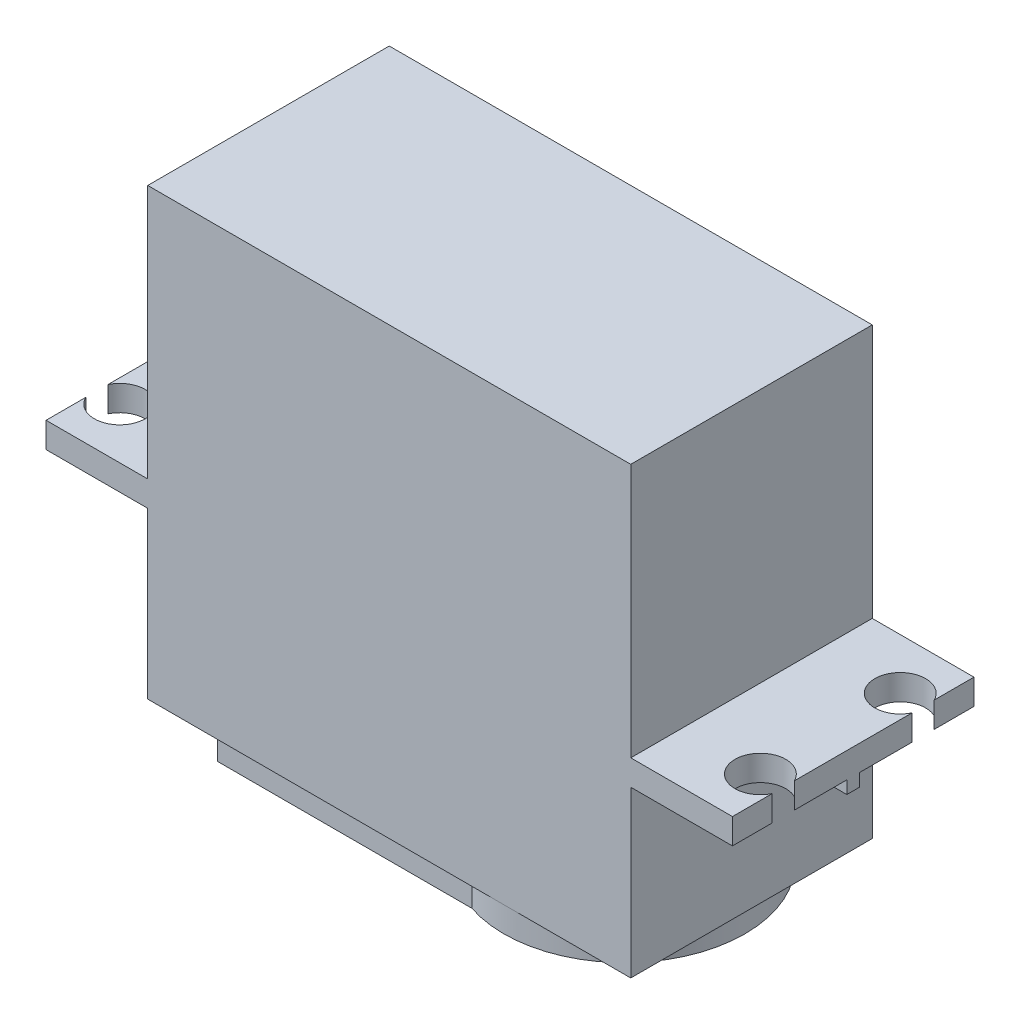
from build123d import *

# Parameters (mm, degrees)
BOSS_EXTRUDE1_DEPTH  = 19
SKETCH6_R            = 2
CUT_EXTRUDE2_DEPTH   = 39.600518131
SKETCH10_W           = 8
SKETCH10_H           = 1
BOSS_EXTRUDE14_DEPTH = 1
BOSS_EXTRUDE15_DEPTH = 2
SKETCH13_R           = 3
CUT_EXTRUDE3_DEPTH   = 5


with BuildPart() as part:
    # Sketch1 → Boss-Extrude1 (new body)
    with BuildSketch(Plane.XY):
        Polygon((19, 0), (-19, 0), (-19, 13), (-27, 13), (-27, 15), (-19, 15), (-19, 35), (19, 35), (19, 15), (27, 15), (27, 13), (19, 13), align=None)
    extrude(amount=BOSS_EXTRUDE1_DEPTH)

    # Sketch6 → Cut-Extrude2 (cut, through all)
    with BuildSketch(Plane(origin=(0, 15, 0), x_dir=(1, 0, 0), z_dir=(0, 1, 0))):
        with Locations((25.2, -15)):
            Circle(SKETCH6_R)
        with Locations((25.2, -4)):
            Circle(SKETCH6_R)
        with Locations((-25.2, -4)):
            Circle(SKETCH6_R)
        with Locations((-25.2, -15)):
            Circle(SKETCH6_R)
    extrude(amount=-CUT_EXTRUDE2_DEPTH, mode=Mode.SUBTRACT)

    # Sketch10 → Boss-Extrude14 (add)
    with BuildSketch(Plane.XZ.offset(-13)):
        with Locations((-23, 9.5)):
            Rectangle(SKETCH10_W, SKETCH10_H)
        with Locations((23, 9.5)):
            Rectangle(SKETCH10_W, SKETCH10_H)
    extrude(amount=BOSS_EXTRUDE14_DEPTH)

    # Sketch12 → Boss-Extrude15 (add)
    with BuildSketch(Plane.XZ):
        with BuildLine():
            Line((-14, 18.5), (6, 18.5))
            ThreePointArc((6, 18.5), (18.486832981, 9.5), (6, 0.5))
            Line((6, 0.5), (-14, 0.5))
            Line((-14, 0.5), (-14, 18.5))
        make_face()
    extrude(amount=BOSS_EXTRUDE15_DEPTH)

    # Sketch13 → Cut-Extrude3 (cut)
    with BuildSketch(Plane.XZ.offset(2)):
        with Locations(Location((9, 9.5, 0), (0, 0, 270))):
            Circle(SKETCH13_R)
    extrude(amount=-CUT_EXTRUDE3_DEPTH, mode=Mode.SUBTRACT)


solid = part.part
